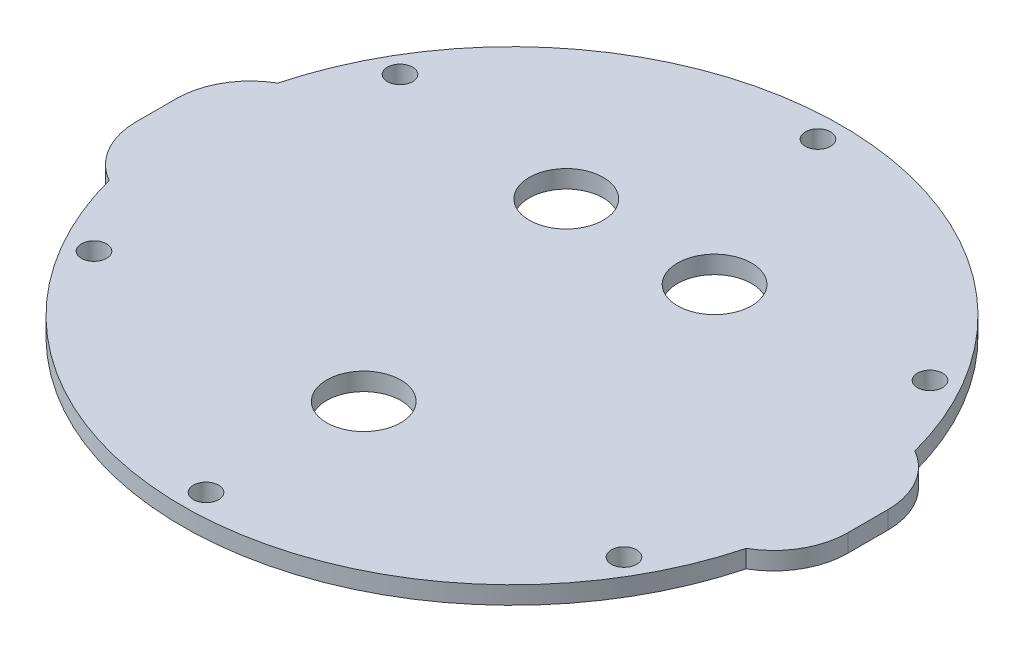
from build123d import *

# Parameters (mm, degrees)
BOSS_EXTRUDE1_DEPTH  = 2.4
M3_CLEARANCE_HOLE1_D = 3.4
CIRPATTERN1_COUNT    = 6
SKETCH8_R            = 5
CUT_EXTRUDE2_DEPTH   = 66.464207778


with BuildPart() as part:
    # Sketch1 → Boss-Extrude1 (new body)
    with BuildSketch(Plane(origin=(0, 0, 0), x_dir=(1, 0, 0), z_dir=(0, 1, 0))):
        with BuildLine():
            ThreePointArc((-42.969094344, -11.378024049), (-44.45, 0), (-42.969094344, 11.378024049))
            ThreePointArc((-42.969094344, 11.378024049), (-46.651327743, 7.715429023), (-48, 2.7))
            Line((-48, 2.7), (-48, -2.7))
            ThreePointArc((-48, -2.7), (-46.651327743, -7.715429023), (-42.969094344, -11.378024049))
        make_face()
        with BuildLine():
            Line((38, 12.7), (-38, 12.7))
            ThreePointArc((-38, 12.7), (-40.570968641, 12.363856386), (-42.969094344, 11.378024049))
            ThreePointArc((-42.969094344, 11.378024049), (-44.45, 0), (-42.969094344, -11.378024049))
            ThreePointArc((-42.969094344, -11.378024049), (-40.570968641, -12.363856386), (-38, -12.7))
            Line((-38, -12.7), (38, -12.7))
            ThreePointArc((38, -12.7), (40.570968641, -12.363856386), (42.969094344, -11.378024049))
            ThreePointArc((42.969094344, -11.378024049), (44.078218791, -5.736996445), (44.45, 0))
            ThreePointArc((44.45, 0), (44.078218791, 5.736996445), (42.969094344, 11.378024049))
            ThreePointArc((42.969094344, 11.378024049), (40.570968641, 12.363856386), (38, 12.7))
        make_face()
        with BuildLine():
            ThreePointArc((-38, -12.7), (-40.570968641, -12.363856386), (-42.969094344, -11.378024049))
            ThreePointArc((-42.969094344, -11.378024049), (0, -44.45), (42.969094344, -11.378024049))
            ThreePointArc((42.969094344, -11.378024049), (40.570968641, -12.363856386), (38, -12.7))
            Line((38, -12.7), (-38, -12.7))
        make_face()
        with BuildLine():
            ThreePointArc((-42.969094344, 11.378024049), (-40.570968641, 12.363856386), (-38, 12.7))
            Line((-38, 12.7), (38, 12.7))
            ThreePointArc((38, 12.7), (40.570968641, 12.363856386), (42.969094344, 11.378024049))
            ThreePointArc((42.969094344, 11.378024049), (0, 44.45), (-42.969094344, 11.378024049))
        make_face()
        with BuildLine():
            ThreePointArc((48, 2.7), (46.651327743, 7.715429023), (42.969094344, 11.378024049))
            ThreePointArc((42.969094344, 11.378024049), (44.078218791, 5.736996445), (44.45, 0))
            ThreePointArc((44.45, 0), (44.078218791, -5.736996445), (42.969094344, -11.378024049))
            ThreePointArc((42.969094344, -11.378024049), (46.651327743, -7.715429023), (48, -2.7))
            Line((48, -2.7), (48, 2.7))
        make_face()
    extrude(amount=BOSS_EXTRUDE1_DEPTH)

    # M3 Clearance Hole1 (through all)
    with Locations(Plane(origin=(0, 2.4, -41.275), x_dir=(0, 0, 1), z_dir=(0, 1, 0))):
        with Locations((0, 0)):
            m3_clearance_hole1 = Hole(M3_CLEARANCE_HOLE1_D / 2)

    # CirPattern1: M3 Clearance Hole1 ×6 about axis
    cirpattern1_axis = Axis((0, 0, 0), (0, 1, 0))
    for i in range(1, CIRPATTERN1_COUNT):
        add(m3_clearance_hole1.rotate(cirpattern1_axis, i * 360 / CIRPATTERN1_COUNT), mode=Mode.SUBTRACT)

    # Sketch8 → Cut-Extrude2 (cut, through all)
    with BuildSketch(Plane(origin=(0, 2.4, 0), x_dir=(1, 0, 0), z_dir=(0, 1, 0))):
        with Locations(Location((-10, 17.320508076, 0), (0, 0, 270))):
            Circle(SKETCH8_R)
        with Locations(Location((10, 17.320508076, 0), (0, 0, 90))):
            Circle(SKETCH8_R)
        with Locations(Location((0, -20, 0), (0, 0, 270))):
            Circle(SKETCH8_R)
    extrude(amount=-CUT_EXTRUDE2_DEPTH, mode=Mode.SUBTRACT)


solid = part.part
